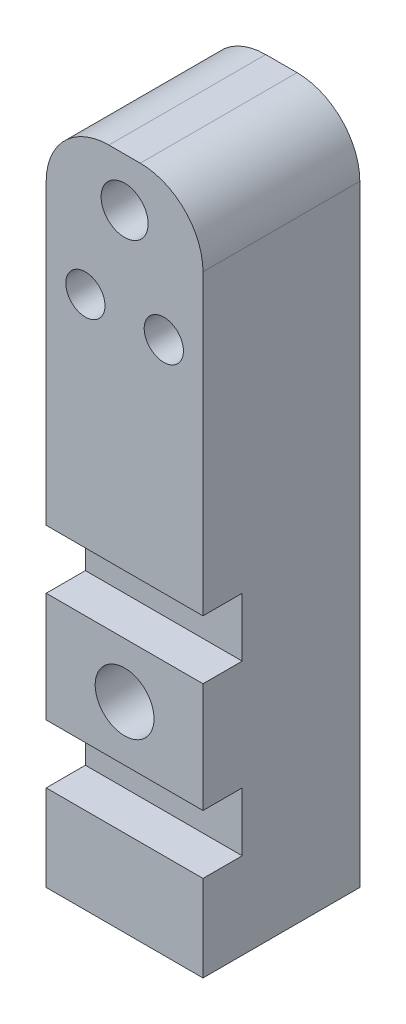
from build123d import *

# Parameters (mm, degrees)
SKETCH2_W           = 1
SKETCH2_H           = 1
BOSS_EXTRUDE1_DEPTH = 4.3
SKETCH3_R           = 0.1
CUT_EXTRUDE1_DEPTH  = 0.7
SKETCH4_W           = 1
SKETCH4_H           = 0.375
CUT_EXTRUDE2_DEPTH  = 0.25
SKETCH5_R           = 0.1875
CUT_EXTRUDE3_DEPTH  = 1
SKETCH7_R           = 0.15
CUT_EXTRUDE6_DEPTH  = 0.65
SKETCH8_R           = 0.125
CUT_EXTRUDE7_DEPTH  = 1
FILLET1_R           = 0.4
SKETCH6_W           = 1
SKETCH6_H           = 0.375
CUT_EXTRUDE8_DEPTH  = 0.25


with BuildPart() as part:
    # Sketch2 → Boss-Extrude1 (new body)
    with BuildSketch(Plane(origin=(0, 0, 0), x_dir=(1, 0, 0), z_dir=(0, 1, 0))):
        Rectangle(SKETCH2_W, SKETCH2_H)
    extrude(amount=BOSS_EXTRUDE1_DEPTH)

    # Sketch3 → Cut-Extrude1 (cut)
    with BuildSketch(Plane.XZ):
        with Locations(Location((0, 0, 0), (0, 0, 270))):
            Circle(SKETCH3_R)
    extrude(amount=-CUT_EXTRUDE1_DEPTH, mode=Mode.SUBTRACT)

    # Sketch4 → Cut-Extrude2 (cut)
    with BuildSketch(Plane.XY.offset(0.5)):
        with Locations((0, 1.8125)):
            Rectangle(SKETCH4_W, SKETCH4_H)
    extrude(amount=-CUT_EXTRUDE2_DEPTH, mode=Mode.SUBTRACT)

    # Sketch5 → Cut-Extrude3 (cut)
    with BuildSketch(Plane.XY.offset(0.5)):
        with Locations((0, 1.275)):
            Circle(SKETCH5_R)
    extrude(amount=-CUT_EXTRUDE3_DEPTH, mode=Mode.SUBTRACT)

    # Sketch7 → Cut-Extrude6 (cut)
    with BuildSketch(Plane.XY.offset(0.5)):
        with Locations((0, 3.99)):
            Circle(SKETCH7_R)
    extrude(amount=-CUT_EXTRUDE6_DEPTH, mode=Mode.SUBTRACT)

    # Sketch8 → Cut-Extrude7 (cut)
    with BuildSketch(Plane.XY.offset(0.5)):
        with Locations((-0.25, 3.4)):
            Circle(SKETCH8_R)
        with Locations((0.25, 3.4)):
            Circle(SKETCH8_R)
    extrude(amount=-CUT_EXTRUDE7_DEPTH, mode=Mode.SUBTRACT)

    # Fillet1
    fillet1_edges = [part.edges().sort_by_distance(p)[0] for p in [
        (-0.5, 4.3, 0),
        (0.5, 4.3, 0),
    ]]
    fillet(fillet1_edges, radius=FILLET1_R)

    # Sketch6 → Cut-Extrude8 (cut)
    with BuildSketch(Plane.XY.offset(0.5)):
        with Locations((0, 0.7375)):
            Rectangle(SKETCH6_W, SKETCH6_H)
    extrude(amount=-CUT_EXTRUDE8_DEPTH, mode=Mode.SUBTRACT)


solid = part.part
